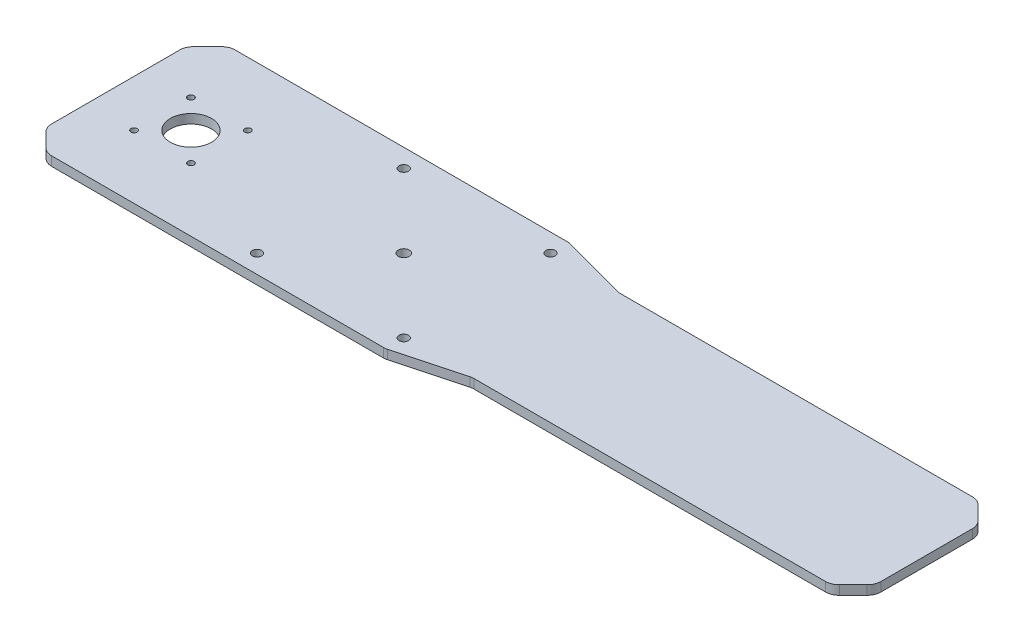
from build123d import *

# Parameters (mm, degrees)
BOSS_EXTRUDE2_DEPTH                                 = 5
CHAMFER2_SIZE                                       = 12
FILLET1_R                                           = 7.5
SKETCH2_R                                           = 2.575
SKETCH2_R_2                                         = 11.25
SKETCH2_R_3                                         = 3
CUT_EXTRUDE1_DEPTH                                  = 290.39592257
CSK_FOR_M3_COUNTERSUNK_FLAT_HEAD_SCREW2_D           = 3.4
CSK_FOR_M3_COUNTERSUNK_FLAT_HEAD_SCREW2_CSINK_D     = 6.3
CSK_FOR_M3_COUNTERSUNK_FLAT_HEAD_SCREW2_CSINK_ANGLE = 90


with BuildPart() as part:
    # Sketch1 → Boss-Extrude2 (new body)
    with BuildSketch(Plane(origin=(0, 0, 0), x_dir=(1, 0, 0), z_dir=(0, 1, 0))):
        Polygon((40, -50), (77.320508076, -40), (285, -40), (285, 40), (77.320508076, 40), (40, 50), (-40, 50), (-157, 50), (-157, -50), (-40, -50), align=None)
    extrude(amount=BOSS_EXTRUDE2_DEPTH)

    # Chamfer2
    chamfer2_edges = [part.edges().sort_by_distance(p)[0] for p in [
        (-157, 2.5, 50),
        (-157, 2.5, -50),
        (285, 2.5, -40),
        (285, 2.5, 40),
    ]]
    chamfer(chamfer2_edges, length=CHAMFER2_SIZE)

    # Fillet1
    fillet1_edges = [part.edges().sort_by_distance(p)[0] for p in [
        (40, 2.5, -50),
        (77.320508076, 2.5, -40),
        (77.320508076, 2.5, 40),
        (40, 2.5, 50),
        (-145, 2.5, 50),
        (-157, 2.5, -38),
        (-157, 2.5, 38),
        (-145, 2.5, -50),
        (273, 2.5, -40),
        (285, 2.5, 28),
        (285, 2.5, -28),
        (273, 2.5, 40),
    ]]
    fillet(fillet1_edges, radius=FILLET1_R)

    # Sketch2 → Cut-Extrude1 (cut, through all)
    with BuildSketch(Plane(origin=(0, 5, 0), x_dir=(1, 0, 0), z_dir=(0, 1, 0))):
        with Locations(Location((-40, 40, 0), (0, 0, 270))):
            Circle(SKETCH2_R)
        with Locations(Location((40, 40, 0), (0, 0, 90))):
            Circle(SKETCH2_R)
        with Locations(Location((40, -40, 0), (0, 0, 270))):
            Circle(SKETCH2_R)
        with Locations(Location((-40, -40, 0), (0, 0, 90))):
            Circle(SKETCH2_R)
        with Locations(Location((-116, 0, 0), (0, 0, 270))):
            Circle(SKETCH2_R_2)
        with Locations(Location((0, 0, 0), (0, 0, 270))):
            Circle(SKETCH2_R_3)
    extrude(amount=-CUT_EXTRUDE1_DEPTH, mode=Mode.SUBTRACT)

    # CSK for M3 Countersunk Flat Head Screw2 (through all)
    with Locations(Plane(origin=(0, 0, 0), x_dir=(-1, 0, 0), z_dir=(0, -1, 0))):
        with Locations((131.5, 15.5), (131.5, -15.5), (100.5, -15.5), (100.5, 15.5)):
            CounterSinkHole(CSK_FOR_M3_COUNTERSUNK_FLAT_HEAD_SCREW2_D / 2, CSK_FOR_M3_COUNTERSUNK_FLAT_HEAD_SCREW2_CSINK_D / 2, counter_sink_angle=CSK_FOR_M3_COUNTERSUNK_FLAT_HEAD_SCREW2_CSINK_ANGLE)


solid = part.part
